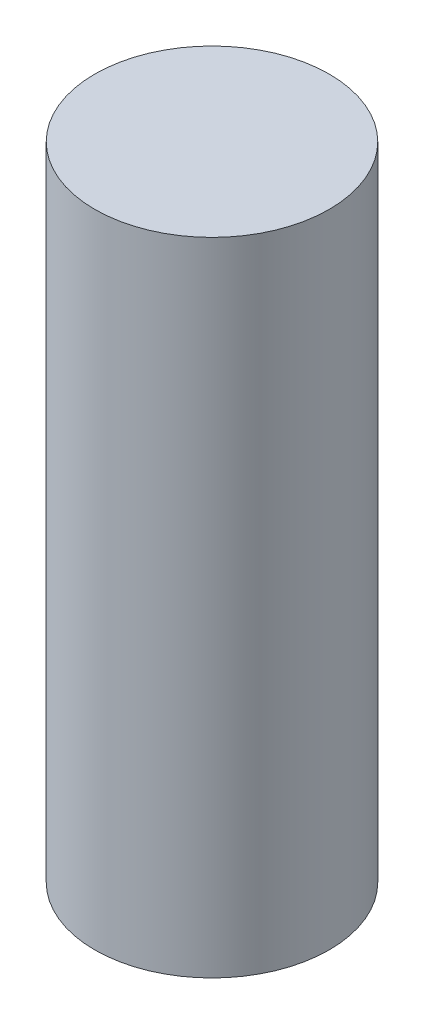
from build123d import *

# Parameters (mm, degrees)
SKETCH_2_R      = 53.004430377
EXTRUDE_1_DEPTH = 145


with BuildPart() as part:
    # 草图2 → 凸台-拉伸1 (new, symmetric)
    with BuildSketch(Plane(origin=(0, 0, 0), x_dir=(1, 0, 0), z_dir=(0, 1, 0))):
        with Locations(Location((21.597622002, 11.054798954, 0), (0, 0, 270))):
            Circle(SKETCH_2_R)
    extrude(amount=EXTRUDE_1_DEPTH, both=True)


solid = part.part
